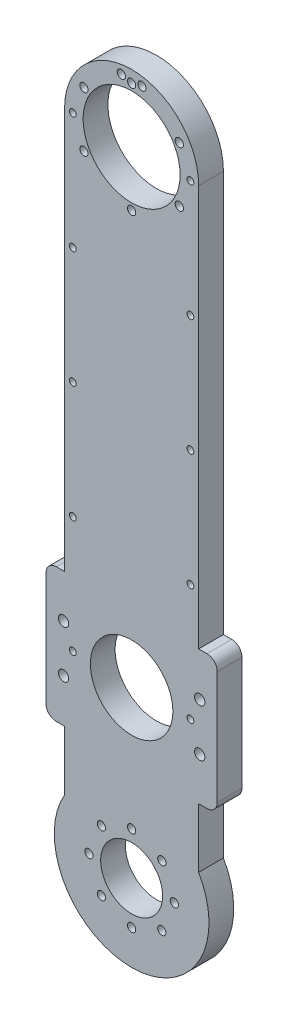
from build123d import *

# Parameters (mm, degrees)
SKETCH1_R             = 20
SKETCH1_R_2           = 37.5
SKETCH1_R_3           = 15
SKETCH1_R_4           = 32.5
SKETCH1_R_5           = 23.5
BOSS_EXTRUDE1_DEPTH   = 12
SKETCH2_R             = 2
CUT_EXTRUDE1_DEPTH    = 13
CIRPATTERN1_COUNT     = 8
SKETCH3_R             = 2
CUT_EXTRUDE2_DEPTH    = 13
CIRPATTERN2_COUNT     = 6
SKETCH6_R             = 2
CUT_EXTRUDE4_DEPTH    = 235.906743238
F_1_0MM_DOWEL_HOLE1_D = 3.3
LPATTERN1_COUNT       = 5
LPATTERN1_PITCH       = 56.5
MIRROR1_COPY_1_D      = 3.3
MIRROR1_COPY_2_D      = 3.3
MIRROR1_COPY_3_D      = 3.3
MIRROR1_COPY_4_D      = 3.3
SKETCH10_W            = 9
SKETCH10_H            = 65
BOSS_EXTRUDE2_DEPTH   = 12
FILLET1_R             = 5
SKETCH12_R            = 2.5
CUT_EXTRUDE5_DEPTH    = 12
FILLET1_OF_MIRROR2_R  = 5


with BuildPart() as part:
    # Sketch1 → Boss-Extrude1 (new body)
    # profile 1 of 3: a face of its own
    with BuildSketch(Plane.XY):
        with BuildLine():
            ThreePointArc((32.5, 199.083522771), (0, 166.583522771), (-32.5, 199.083522771))
            Line((-32.5, 199.083522771), (-32.5, -89.208190296))
            ThreePointArc((-32.5, -89.208190296), (0, -70.416477229), (32.5, -89.208190296))
            Line((32.5, -89.208190296), (32.5, 199.083522771))
        make_face()
        with Locations((0, -27.916477229)):
            Circle(SKETCH1_R, mode=Mode.SUBTRACT)
    # profile 2 of 3: a face of its own
    with BuildSketch(Plane.XY):
        with Locations((0, -107.916477229)):
            Circle(SKETCH1_R_2)
        with Locations((0, -107.916477229)):
            Circle(SKETCH1_R_3, mode=Mode.SUBTRACT)
    # profile 3 of 3: a face of its own
    with BuildSketch(Plane.XY):
        with Locations((0, 199.083522771)):
            Circle(SKETCH1_R_4)
        with Locations((0, 199.083522771)):
            Circle(SKETCH1_R_5, mode=Mode.SUBTRACT)
    extrude(amount=BOSS_EXTRUDE1_DEPTH)

    # Sketch2 → Cut-Extrude1 (cut)
    with BuildSketch(Plane(origin=(0, 0, 0), x_dir=(-1, 0, 0), z_dir=(0, 0, -1))):
        with Locations((-20.7, -107.916477229)):
            Circle(SKETCH2_R)
    cut_extrude1 = extrude(amount=-CUT_EXTRUDE1_DEPTH, mode=Mode.SUBTRACT)

    # CirPattern1: Cut-Extrude1 ×8 about axis
    cirpattern1_axis = Axis((0, -107.916477229, 0), (0, 0, 1))
    for i in range(1, CIRPATTERN1_COUNT):
        add(cut_extrude1.rotate(cirpattern1_axis, i * 360 / CIRPATTERN1_COUNT), mode=Mode.SUBTRACT)

    # Sketch3 → Cut-Extrude2 (cut)
    with BuildSketch(Plane(origin=(0, 0, 0), x_dir=(-1, 0, 0), z_dir=(0, 0, -1))):
        with Locations((0, 225.783522771)):
            Circle(SKETCH3_R)
    cut_extrude2 = extrude(amount=-CUT_EXTRUDE2_DEPTH, mode=Mode.SUBTRACT)

    # CirPattern2: Cut-Extrude2 ×6 about axis
    cirpattern2_axis = Axis((0, 199.083522771, 0), (0, 0, 1))
    for i in range(1, CIRPATTERN2_COUNT):
        add(cut_extrude2.rotate(cirpattern2_axis, i * 360 / CIRPATTERN2_COUNT), mode=Mode.SUBTRACT)

    # Sketch6 → Cut-Extrude4 (cut, through all)
    with BuildSketch(Plane(origin=(0, 0, 0), x_dir=(-1, 0, 0), z_dir=(0, 0, -1))):
        with Locations((-5, 227.083522771)):
            Circle(SKETCH6_R)
        with Locations((5, 227.083522771)):
            Circle(SKETCH6_R)
    extrude(amount=-CUT_EXTRUDE4_DEPTH, mode=Mode.SUBTRACT)

    # Ø1.0mm Dowel Hole1 (through all)
    with Locations(Plane(origin=(0, 0, 0), x_dir=(-1, 0, 0), z_dir=(0, 0, -1))):
        with Locations((-28.5, 199.083522771)):
            f_1_0mm_dowel_hole1 = Hole(F_1_0MM_DOWEL_HOLE1_D / 2)

    # LPattern1: Ø1.0mm Dowel Hole1 ×5
    with Locations(*[(0, -i * LPATTERN1_PITCH, 0) for i in range(1, LPATTERN1_COUNT)]):
        add(f_1_0mm_dowel_hole1, mode=Mode.SUBTRACT)

    # Mirror1: Ø1.0mm Dowel Hole1 across plane
    add(f_1_0mm_dowel_hole1.mirror(Plane(origin=(0, 0, 0), x_dir=(0, 0, 1), z_dir=(1, 0, 0))), mode=Mode.SUBTRACT)

    # Mirror1 copy 1 (through all)
    with Locations(Plane(origin=(0, -56.5, 0), x_dir=(1, 0, 0), z_dir=(0, 0, -1))):
        with Locations((-28.5, -199.083522771)):
            Hole(MIRROR1_COPY_1_D / 2)

    # Mirror1 copy 2 (through all)
    with Locations(Plane(origin=(0, -113, 0), x_dir=(1, 0, 0), z_dir=(0, 0, -1))):
        with Locations((-28.5, -199.083522771)):
            Hole(MIRROR1_COPY_2_D / 2)

    # Mirror1 copy 3 (through all)
    with Locations(Plane(origin=(0, -169.5, 0), x_dir=(1, 0, 0), z_dir=(0, 0, -1))):
        with Locations((-28.5, -199.083522771)):
            Hole(MIRROR1_COPY_3_D / 2)

    # Mirror1 copy 4 (through all)
    with Locations(Plane(origin=(0, -226, 0), x_dir=(1, 0, 0), z_dir=(0, 0, -1))):
        with Locations((-28.5, -199.083522771)):
            Hole(MIRROR1_COPY_4_D / 2)

    # Sketch10 → Boss-Extrude2 (add)
    with BuildSketch(Plane.XY.offset(12)):
        with Locations((-37, -27.916477229)):
            Rectangle(SKETCH10_W, SKETCH10_H)
    boss_extrude2 = extrude(amount=-BOSS_EXTRUDE2_DEPTH)

    # Fillet1
    fillet1_edges = [part.edges().sort_by_distance(p)[0] for p in [
        (-41.5, -60.416477229, 6),
        (-41.5, 4.583522771, 6),
    ]]
    fillet(fillet1_edges, radius=FILLET1_R)

    # Sketch12 → Cut-Extrude5 (cut)
    with BuildSketch(Plane.XY.offset(12)):
        with Locations((-33, -16.416477229)):
            Circle(SKETCH12_R)
        with Locations((-33, -39.416477229)):
            Circle(SKETCH12_R)
    cut_extrude5 = extrude(amount=-CUT_EXTRUDE5_DEPTH, mode=Mode.SUBTRACT)

    # Mirror2: Boss-Extrude2, Cut-Extrude5 across plane
    add(boss_extrude2.mirror(Plane(origin=(0, 0, 0), x_dir=(0, 0, 1), z_dir=(1, 0, 0))))
    add(cut_extrude5.mirror(Plane(origin=(0, 0, 0), x_dir=(0, 0, 1), z_dir=(1, 0, 0))), mode=Mode.SUBTRACT)

    # Fillet1 of Mirror2
    fillet1_of_mirror2_edges = [part.edges().sort_by_distance(p)[0] for p in [
        (41.5, -60.416477229, 6),
        (41.5, 4.583522771, 6),
    ]]
    fillet(fillet1_of_mirror2_edges, radius=FILLET1_OF_MIRROR2_R)


solid = part.part
